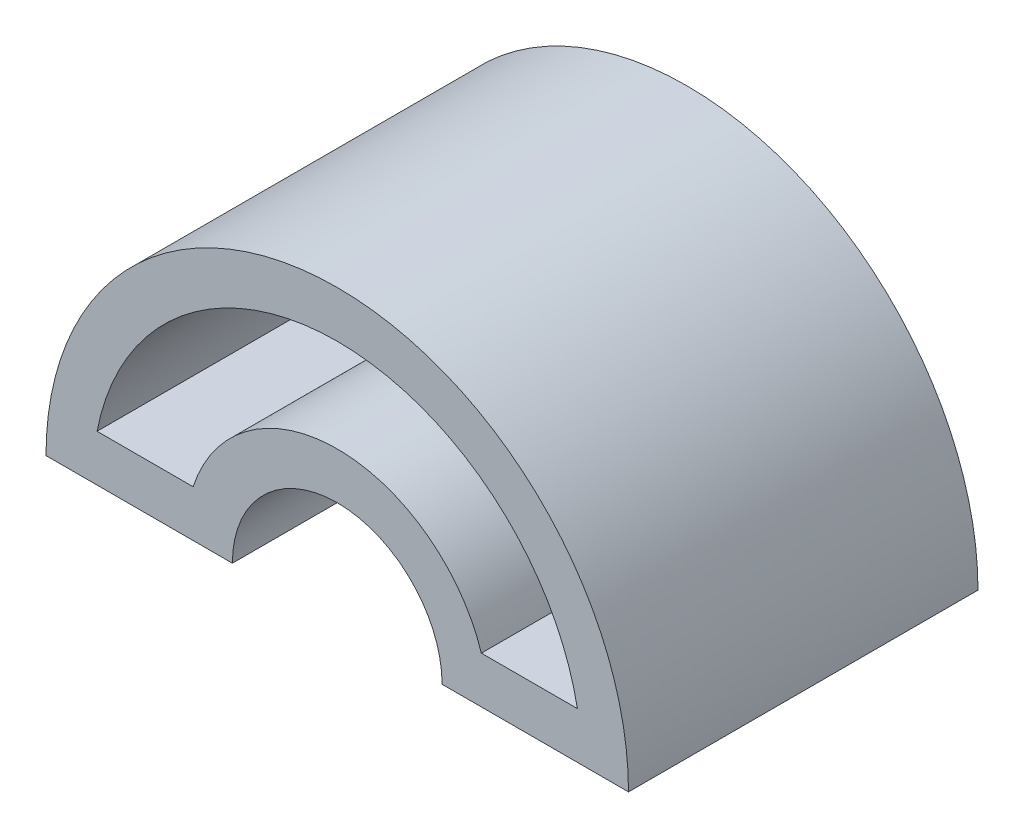
from build123d import *

# Parameters (mm, degrees)
EXTRUDE_1_DEPTH = 60


with BuildPart() as part:
    # 草图1 → 凸台-拉伸1 (new body)
    with BuildSketch(Plane.XY):
        with BuildLine():
            Line((-50, 0), (-18, 0))
            ThreePointArc((-18, 0), (0, 18), (18, 0))
            Line((18, 0), (50, 0))
            ThreePointArc((50, 0), (0, 50), (-50, 0))
        make_face()
        with BuildLine():
            Line((-41.231056256, 8), (-24.738633754, 8))
            ThreePointArc((-24.738633754, 8), (0, 26), (24.738633754, 8))
            Line((24.738633754, 8), (41.231056256, 8))
            ThreePointArc((41.231056256, 8), (0, 42), (-41.231056256, 8))
        make_face(mode=Mode.SUBTRACT)
    extrude(amount=EXTRUDE_1_DEPTH)


solid = part.part
